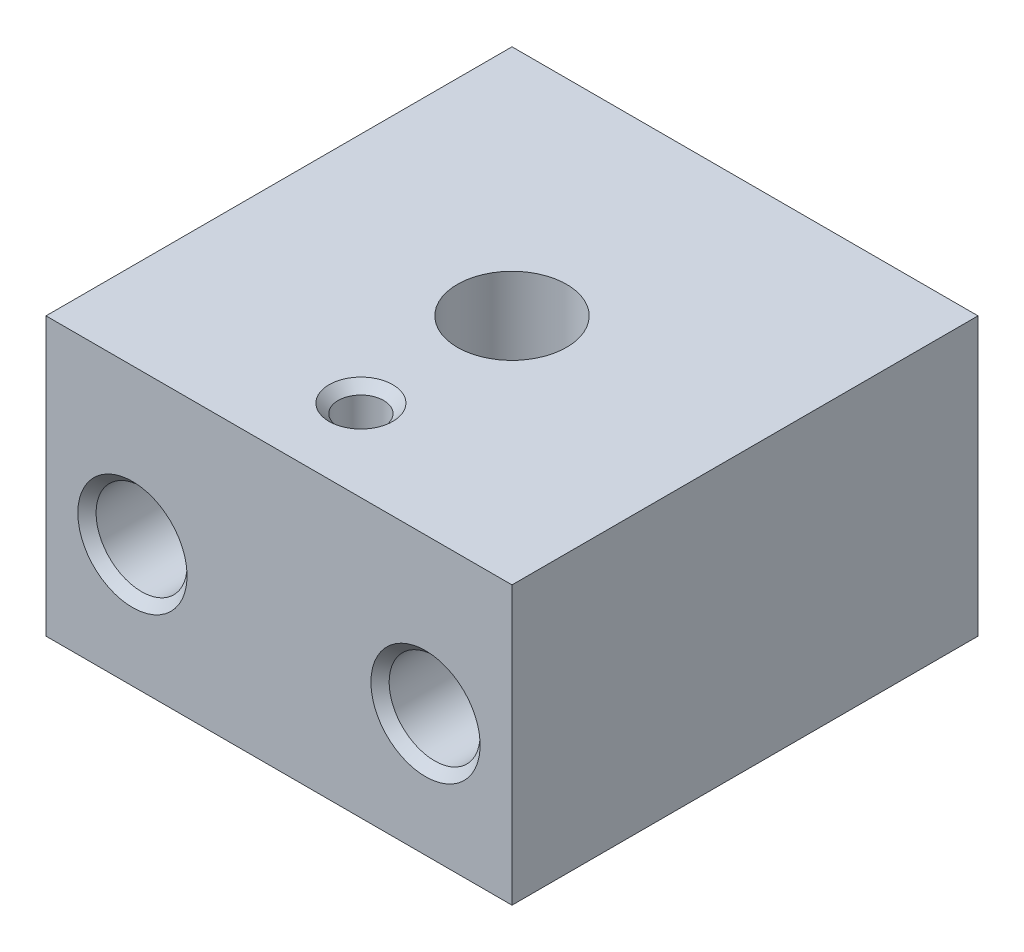
from build123d import *

# Parameters (mm, degrees)
SKETCH1_W           = 25.6
SKETCH1_H           = 25.6
BOSS_EXTRUDE1_DEPTH = 15.24
SKETCH2_R           = 2.5
CUT_EXTRUDE1_DEPTH  = 33.426186948
SKETCH3_R           = 1.25
CUT_EXTRUDE2_DEPTH  = 24.663000655
CHAMFER1_SIZE       = 0.5
SKETCH7_R           = 3
CUT_EXTRUDE3_DEPTH  = 24.663000655


with BuildPart() as part:
    # Sketch1 → Boss-Extrude1 (new body)
    with BuildSketch(Plane(origin=(0, 0, 0), x_dir=(1, 0, 0), z_dir=(0, 1, 0))):
        Rectangle(SKETCH1_W, SKETCH1_H)
    extrude(amount=BOSS_EXTRUDE1_DEPTH)

    # Sketch2 → Cut-Extrude1 (cut, through all)
    with BuildSketch(Plane.XY.offset(12.8)):
        with Locations((-8.05, 6.74)):
            Circle(SKETCH2_R)
        with Locations((8.05, 6.74)):
            Circle(SKETCH2_R)
    extrude(amount=-CUT_EXTRUDE1_DEPTH, mode=Mode.SUBTRACT)

    # Sketch3 → Cut-Extrude2 (cut, through all)
    with BuildSketch(Plane(origin=(0, 15.24, 0), x_dir=(1, 0, 0), z_dir=(0, 1, 0))):
        with Locations(Location((0, -8.3, 0), (0, 0, 270))):
            Circle(SKETCH3_R)
    extrude(amount=-CUT_EXTRUDE2_DEPTH, mode=Mode.SUBTRACT)

    # Chamfer1
    chamfer1_edges = [part.edges().sort_by_distance(p)[0] for p in [
        (-10.55, 6.74, -12.8),
        (-10.55, 6.74, 12.8),
        (5.55, 6.74, -12.8),
        (5.55, 6.74, 12.8),
        (0, 0, 7.05),
        (0, 15.24, 7.05),
    ]]
    chamfer(chamfer1_edges, length=CHAMFER1_SIZE)

    # Sketch7 → Cut-Extrude3 (cut, through all)
    with BuildSketch(Plane(origin=(0, 15.24, 0), x_dir=(1, 0, 0), z_dir=(0, 1, 0))):
        with Locations(Location((0, 0, 0), (0, 0, 270))):
            Circle(SKETCH7_R)
    extrude(amount=-CUT_EXTRUDE3_DEPTH, mode=Mode.SUBTRACT)


solid = part.part
